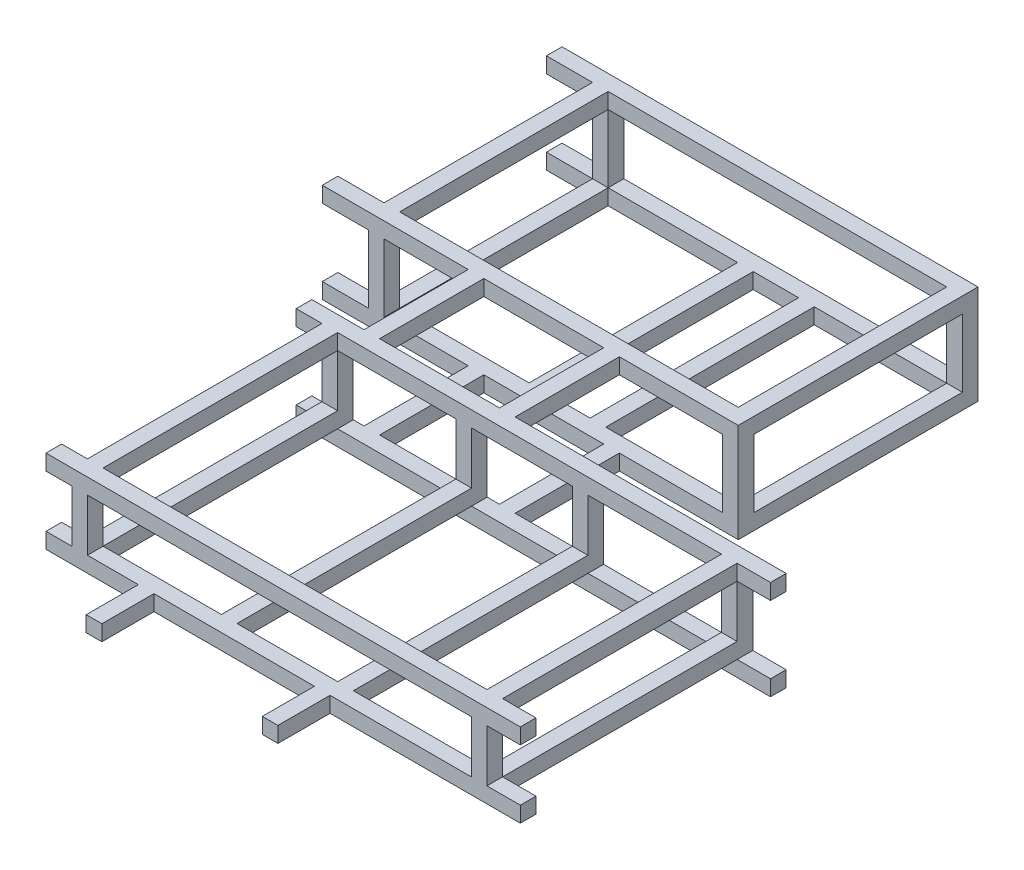
from build123d import *

# Parameters (mm, degrees)
SKETCH_1_W          = 30
SKETCH_1_H          = 450
SKETCH_1_W_2        = 910
SKETCH_1_H_2        = 30
EXTRUDE_1_DEPTH     = 30
SKETCH_2_W          = 30.109824799
SKETCH_2_H          = 30
SKETCH_2_W_2        = 30
EXTRUDE_2_DEPTH     = 100
SKETCH_3_W          = 49.418401049
SKETCH_3_H          = 30
SKETCH_3_W_2        = 30
SKETCH_3_W_3        = 910
SKETCH_3_H_2        = 450
EXTRUDE_3_DEPTH     = 30
SKETCH_4_W          = 850
SKETCH_4_H          = 30
SKETCH_4_W_2        = 30
SKETCH_4_H_2        = 400
EXTRUDE_4_DEPTH     = 30
SKETCH_5_W          = 30
SKETCH_5_H          = 30
EXTRUDE_5_DEPTH     = 130
SKETCH_6_W          = 88.479210194
SKETCH_6_H          = 30
SKETCH_6_W_2        = 30
SKETCH_6_H_2        = 400
SKETCH_6_W_3        = 850
EXTRUDE_6_DEPTH     = 30
SKETCH_8_W          = 736.515263892
SKETCH_8_H          = 30
SKETCH_8_W_2        = 64.066335059
SKETCH_8_W_3        = 49.418401049
CUT_EXTRUDE_2_DEPTH = 30
SKETCH_9_W          = 910
SKETCH_9_H          = 30
EXTRUDE_7_DEPTH     = 30
SKETCH_12_W         = 30
SKETCH_12_H         = 130
EXTRUDE_8_DEPTH     = 30
SKETCH_13_W         = 30
SKETCH_13_H         = 200
EXTRUDE_9_DEPTH     = 30
SKETCH_14_W         = 30
SKETCH_14_H         = 200
EXTRUDE_10_DEPTH    = 30
SKETCH_15_W         = 489.531957018
SKETCH_15_H         = 254.722560686
CUT_EXTRUDE_3_DEPTH = 51.972649134
SKETCH_16_W         = 30
SKETCH_16_H         = 30
EXTRUDE_11_DEPTH    = 100


with BuildPart() as part:
    # 草图1 → 凸台-拉伸1 (new body)
    with BuildSketch(Plane(origin=(0, 0, 0), x_dir=(1, 0, 0), z_dir=(0, 1, 0))):
        with Locations((64.418401049, 255)):
            Rectangle(SKETCH_1_W, SKETCH_1_H)
        with Locations((455, 15)):
            Rectangle(SKETCH_1_W_2, SKETCH_1_H_2)
        with Locations((321.408548695, 255)):
            Rectangle(SKETCH_1_W, SKETCH_1_H)
        with Locations((544.693031268, 255)):
            Rectangle(SKETCH_1_W, SKETCH_1_H)
        with Locations((830.933664941, 255)):
            Rectangle(SKETCH_1_W, SKETCH_1_H)
        Polygon((0, 480), (49.418401049, 480), (79.418401049, 480), (306.408548695, 480), (336.408548695, 480), (529.693031268, 480), (559.693031268, 480), (815.933664941, 480), (845.933664941, 480), (910, 480), (910, 510), (0, 510), align=None)
    extrude(amount=EXTRUDE_1_DEPTH)

    # 草图2 → 凸台-拉伸2 (add)
    with BuildSketch(Plane(origin=(0, 30, 0), x_dir=(1, 0, 0), z_dir=(0, 1, 0))):
        with Locations((64.473313449, 15)):
            Rectangle(SKETCH_2_W, SKETCH_2_H)
        with Locations((830.933664941, 15)):
            Rectangle(SKETCH_2_W_2, SKETCH_2_H)
        with Locations((64.418401049, 495)):
            Rectangle(SKETCH_2_W_2, SKETCH_2_H)
        with Locations((830.933664941, 495)):
            Rectangle(SKETCH_2_W_2, SKETCH_2_H)
    extrude(amount=EXTRUDE_2_DEPTH)

    # 草图3 → 凸台-拉伸3 (add)
    with BuildSketch(Plane(origin=(0, 130, 0), x_dir=(1, 0, 0), z_dir=(0, 1, 0))):
        Polygon((910, 510), (79.418401049, 510), (79.418401049, 480), (79.528225848, 480), (815.933664941, 480), (845.933664941, 480), (910, 480), align=None)
        with Locations((24.709200525, 495)):
            Rectangle(SKETCH_3_W, SKETCH_3_H)
        with Locations((64.418401049, 495)):
            Rectangle(SKETCH_3_W_2, SKETCH_3_H)
        with Locations((455, 15)):
            Rectangle(SKETCH_3_W_3, SKETCH_3_H)
        Polygon((79.418401049, 480), (49.418401049, 480), (49.418401049, 30), (79.528225848, 30), (79.528225848, 480), align=None)
        with Locations((830.933664941, 255)):
            Rectangle(SKETCH_3_W_2, SKETCH_3_H_2)
    extrude(amount=EXTRUDE_3_DEPTH)

    # 草图8 → 切除-拉伸2 (cut)
    with BuildSketch(Plane(origin=(0, 0, -510), x_dir=(-1, 0, 0), z_dir=(0, 0, -1))):
        with Locations((-447.676032995, 15)):
            Rectangle(SKETCH_8_W, SKETCH_8_H)
        with Locations((-877.966832471, 15)):
            Rectangle(SKETCH_8_W_2, SKETCH_8_H)
        with Locations((-24.709200525, 15)):
            Rectangle(SKETCH_8_W_3, SKETCH_8_H)
    extrude(amount=-CUT_EXTRUDE_2_DEPTH, mode=Mode.SUBTRACT)



with BuildPart() as body_2:
    # 草图4 → 凸台-拉伸4 (new body)
    with BuildSketch(Plane(origin=(0, 160, 0), x_dir=(1, 0, 0), z_dir=(0, 1, 0))):
        with Locations((245, 725)):
            Rectangle(SKETCH_4_W, SKETCH_4_H)
        with Locations((245, 1155)):
            Rectangle(SKETCH_4_W, SKETCH_4_H)
        with Locations((-76.520789806, 940)):
            Rectangle(SKETCH_4_W_2, SKETCH_4_H_2)
        with Locations((603.027350866, 940)):
            Rectangle(SKETCH_4_W_2, SKETCH_4_H_2)
    extrude(amount=-EXTRUDE_4_DEPTH)

    # 草图5 → 凸台-拉伸5 (add)
    with BuildSketch(Plane(origin=(0, 130, 0), x_dir=(-1, 0, 0), z_dir=(0, -1, 0))):
        with Locations((76.520789806, 725)):
            Rectangle(SKETCH_5_W, SKETCH_5_H)
        with Locations((-603.027350866, 725)):
            Rectangle(SKETCH_5_W, SKETCH_5_H)
        with Locations((-603.027350866, 1155)):
            Rectangle(SKETCH_5_W, SKETCH_5_H)
        with Locations((76.520789806, 1155)):
            Rectangle(SKETCH_5_W, SKETCH_5_H)
    extrude(amount=EXTRUDE_5_DEPTH)

    # 草图6 → 凸台-拉伸6 (add)
    with BuildSketch(Plane(origin=(0, 0, 0), x_dir=(-1, 0, 0), z_dir=(0, -1, 0))):
        Polygon((-670, 710), (61.520789806, 710), (61.520789806, 740), (-186.822629959, 740), (-216.822629959, 740), (-303.86127731, 740), (-333.86127731, 740), (-588.027350866, 740), (-618.027350866, 740), (-670, 740), align=None)
        with Locations((135.760394903, 725)):
            Rectangle(SKETCH_6_W, SKETCH_6_H)
        with Locations((76.520789806, 725)):
            Rectangle(SKETCH_6_W_2, SKETCH_6_H)
        with Locations((76.520789806, 940)):
            Rectangle(SKETCH_6_W_2, SKETCH_6_H_2)
        with Locations((-201.822629959, 940)):
            Rectangle(SKETCH_6_W_2, SKETCH_6_H_2)
        with Locations((-318.86127731, 940)):
            Rectangle(SKETCH_6_W_2, SKETCH_6_H_2)
        with Locations((-603.027350866, 940)):
            Rectangle(SKETCH_6_W_2, SKETCH_6_H_2)
        with Locations((-245, 1155)):
            Rectangle(SKETCH_6_W_3, SKETCH_6_H)
    extrude(amount=EXTRUDE_6_DEPTH)


with BuildPart() as body_3:
    # 草图9 → 凸台-拉伸7 (new body)
    with BuildSketch(Plane(origin=(0, -30, 0), x_dir=(-1, 0, 0), z_dir=(0, -1, 0))):
        with Locations((-455, 495)):
            Rectangle(SKETCH_9_W, SKETCH_9_H)
    extrude(amount=-EXTRUDE_7_DEPTH)


with BuildPart() as part_1:
    add(part.part)

    add(body_3.part)  # 凸台-拉伸8 merges body 3
    # 草图12 → 凸台-拉伸8 (add)
    with BuildSketch(Plane(origin=(0, 0, -510), x_dir=(-1, 0, 0), z_dir=(0, 0, -1))):
        with Locations((-544.693031268, 65)):
            Rectangle(SKETCH_12_W, SKETCH_12_H)
        with Locations((-321.408548695, 65)):
            Rectangle(SKETCH_12_W, SKETCH_12_H)
    extrude(amount=-EXTRUDE_8_DEPTH)


    add(body_2.part)  # 凸台-拉伸9 merges body 2
    # 草图13 → 凸台-拉伸9 (add)
    with BuildSketch(Plane(origin=(0, -30, 0), x_dir=(-1, 0, 0), z_dir=(0, -1, 0))):
        with Locations((-115, 610)):
            Rectangle(SKETCH_13_W, SKETCH_13_H)
        with Locations((-375, 610)):
            Rectangle(SKETCH_13_W, SKETCH_13_H)
    extrude(amount=-EXTRUDE_9_DEPTH)

    # 草图14 → 凸台-拉伸10 (add)
    with BuildSketch(Plane(origin=(0, 160, 0), x_dir=(1, 0, 0), z_dir=(0, 1, 0))):
        with Locations((115, 610)):
            Rectangle(SKETCH_14_W, SKETCH_14_H)
        with Locations((375, 610)):
            Rectangle(SKETCH_14_W, SKETCH_14_H)
    extrude(amount=-EXTRUDE_10_DEPTH)

    # 草图15 → 切除-拉伸3 (cut)
    with BuildSketch(Plane(origin=(670, 0, 0), x_dir=(0, 0, -1), z_dir=(1, 0, 0))):
        with Locations((948.415249447, 56.198014116)):
            Rectangle(SKETCH_15_W, SKETCH_15_H)
    extrude(amount=-CUT_EXTRUDE_3_DEPTH, mode=Mode.SUBTRACT)

    # 草图16 → 凸台-拉伸11 (add)
    with BuildSketch(Plane.XY):
        with Locations((192.165247783, 15)):
            Rectangle(SKETCH_16_W, SKETCH_16_H)
        with Locations((529.958608766, 15)):
            Rectangle(SKETCH_16_W, SKETCH_16_H)
    extrude(amount=EXTRUDE_11_DEPTH)


solid = part_1.part
